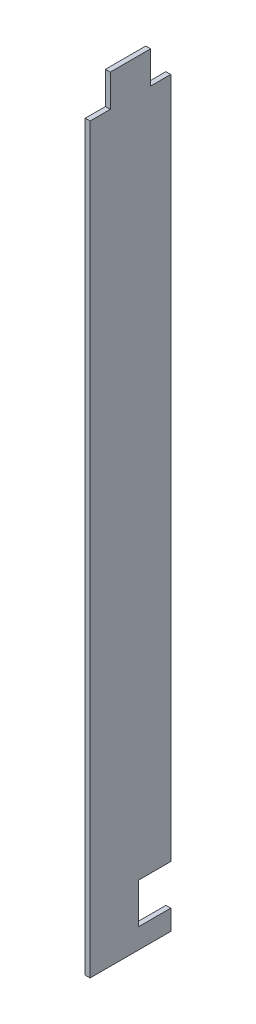
from build123d import *

# Parameters (mm, degrees)
ESQUISSE1_W             = 50
ESQUISSE1_H             = 460
BOSS_EXTRU_1_DEPTH      = 3
ESQUISSE2_W             = 20
ESQUISSE2_H             = 25
ENL_V_MAT_EXTRU_2_DEPTH = 232.37415586
ESQUISSE5_W             = 25
ESQUISSE5_H             = 20
BOSS_EXTRU_3_DEPTH      = 3


with BuildPart() as part:
    # Esquisse1 → Boss.-Extru.1 (new body)
    with BuildSketch(Plane(origin=(0, 0, 0), x_dir=(0, 0, -1), z_dir=(1, 0, 0))):
        Rectangle(ESQUISSE1_W, ESQUISSE1_H)
    extrude(amount=BOSS_EXTRU_1_DEPTH)

    # Esquisse2 → Enlèv. mat.-Extru.2 (cut, through all)
    with BuildSketch(Plane(origin=(3, 0, 0), x_dir=(0, 0, -1), z_dir=(1, 0, 0))):
        with Locations((15, -205)):
            Rectangle(ESQUISSE2_W, ESQUISSE2_H)
    extrude(amount=-ENL_V_MAT_EXTRU_2_DEPTH, mode=Mode.SUBTRACT)

    # Esquisse5 → Boss.-Extru.3 (add)
    with BuildSketch(Plane(origin=(3, 0, 0), x_dir=(0, 0, -1), z_dir=(1, 0, 0))):
        with Locations((0, 240)):
            Rectangle(ESQUISSE5_W, ESQUISSE5_H)
    extrude(amount=-BOSS_EXTRU_3_DEPTH)


solid = part.part
